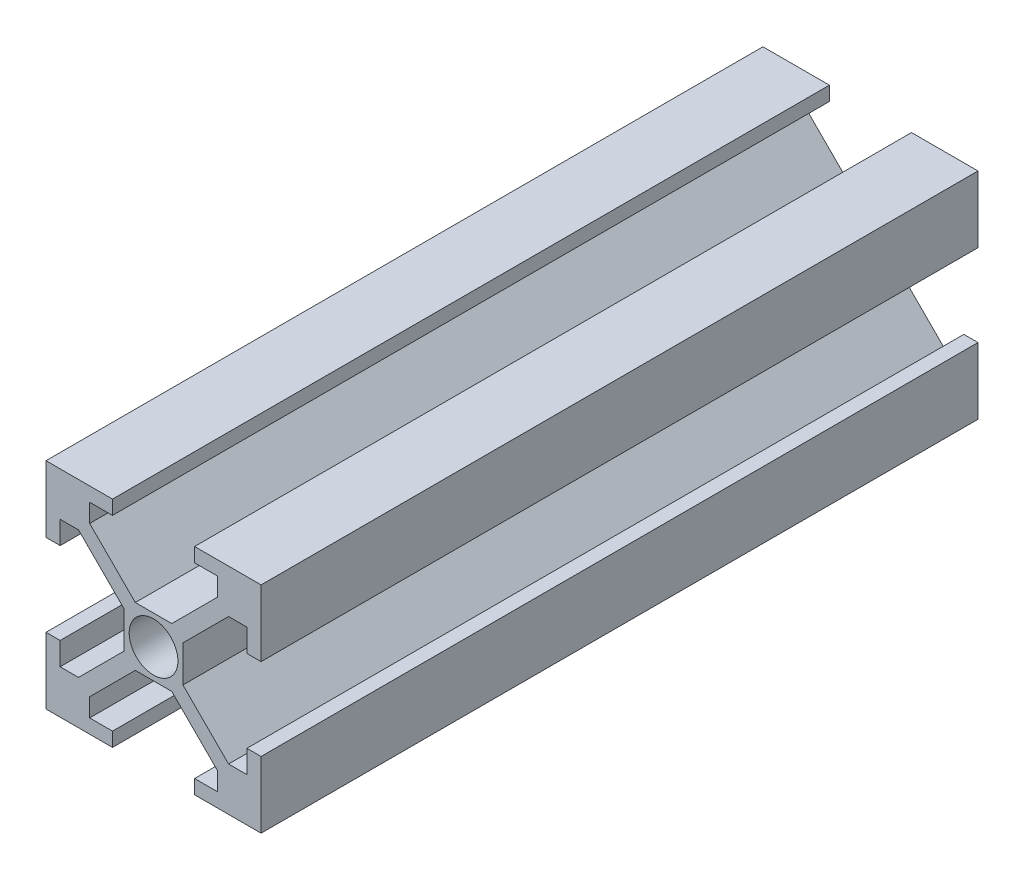
from build123d import *

# Parameters (mm, degrees)
SKETCH3_R           = 3.4
BOSS_EXTRUDE1_DEPTH = 100


with BuildPart() as part:
    # Sketch3 → Boss-Extrude1 (new body)
    with BuildSketch(Plane.XY):
        Polygon((-4.1, 2.544365081), (-4.1, -2.544365081), (-10.463961031, -8.908326112), (-13.02814489, -8.908326112), (-13.02814489, -5.726345597), (-15, -5.726345597), (-15, -15), (-5.726345597, -15), (-5.726345597, -13.02814489), (-8.908326112, -13.02814489), (-8.908326112, -10.463961031), (-2.544365081, -4.1), (2.544365081, -4.1), (8.908326112, -10.463961031), (8.908326112, -13.02814489), (5.726345597, -13.02814489), (5.726345597, -15), (15, -15), (15, -5.726345597), (13.02814489, -5.726345597), (13.02814489, -8.908326112), (10.463961031, -8.908326112), (4.1, -2.544365081), (4.1, 2.544365081), (10.463961031, 8.908326112), (13.02814489, 8.908326112), (13.02814489, 5.726345597), (15, 5.726345597), (15, 15), (5.726345597, 15), (5.726345597, 13.02814489), (8.908326112, 13.02814489), (8.908326112, 10.463961031), (2.544365081, 4.1), (-2.544365081, 4.1), (-8.908326112, 10.463961031), (-8.908326112, 13.02814489), (-5.726345597, 13.02814489), (-5.726345597, 15), (-15, 15), (-15, 5.726345597), (-13.02814489, 5.726345597), (-13.02814489, 8.908326112), (-10.463961031, 8.908326112), align=None)
        Circle(SKETCH3_R, mode=Mode.SUBTRACT)
    extrude(amount=BOSS_EXTRUDE1_DEPTH)


solid = part.part
